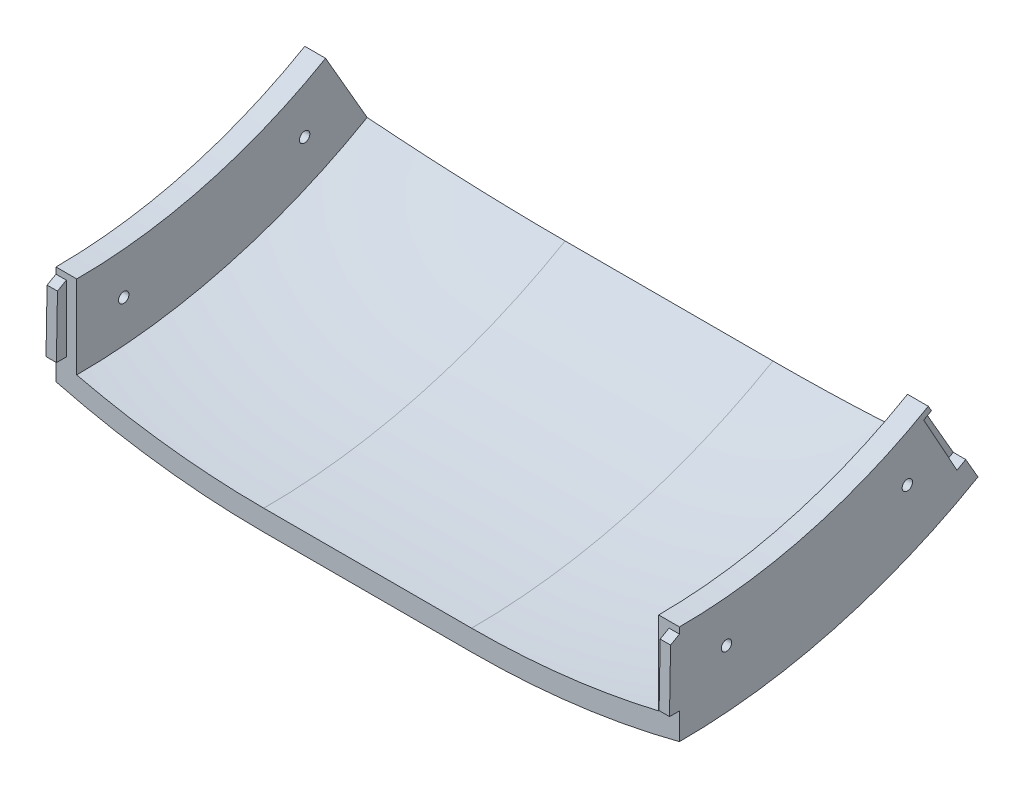
from build123d import *

# Parameters (mm, degrees)
R_VOLUTION3_ANGLE                       = 30
ESQUISSE2_W                             = 5
ESQUISSE2_H                             = 32
R_VOLUTION4_ANGLE                       = 1
ESQUISSE3_W                             = 6
ESQUISSE3_H                             = 33
ENL_VEMENT_DE_MATI_RE_R_VOLUTION1_ANGLE = 1
ENL_V_MAT_EXTRU_1_DEPTH                 = 300
ESQUISSE5_R                             = 2.5
ENL_V_MAT_EXTRU_2_DEPTH                 = 300


with BuildPart() as part:
    # Esquisse1 → Révolution3 (revolve)
    with BuildSketch(Plane.XY):
        with BuildLine():
            Line((-50, -300), (50, -300))
            ThreePointArc((50, -300), (100.401716993, -296.811878507), (150, -287.298334621))
            Line((150, -287.298334621), (150, -239.47331922))
            Line((150, -239.47331922), (140, -239.47331922))
            Line((140, -239.47331922), (140, -279.47331922))
            ThreePointArc((140, -279.47331922), (95.306762763, -287.359390293), (50, -290))
            Line((50, -290), (-50, -290))
            ThreePointArc((-50, -290), (-95.306762763, -287.359390293), (-140, -279.47331922))
            Line((-140, -279.47331922), (-140, -239.47331922))
            Line((-140, -239.47331922), (-150, -239.47331922))
            Line((-150, -239.47331922), (-150, -287.298334621))
            ThreePointArc((-150, -287.298334621), (-100.401716993, -296.811878507), (-50, -300))
        make_face()
    revolve(axis=Axis((0, 0, 0), (1, 0, 0)), revolution_arc=R_VOLUTION3_ANGLE)

    # Esquisse2 → Révolution4 (revolve)
    with BuildSketch(Plane.XY):
        with Locations((-147.5, -258.47331922)):
            Rectangle(ESQUISSE2_W, ESQUISSE2_H)
        with Locations((147.5, -258.47331922)):
            Rectangle(ESQUISSE2_W, ESQUISSE2_H)
    revolve(axis=Axis((-163.497361966, 0, 0), (-1, 0, 0)), revolution_arc=R_VOLUTION4_ANGLE)

    # Esquisse3 → Enlèvement de matière-Révolution1 (revolve, cut)
    with BuildSketch(Plane(origin=(0, 0, 0), x_dir=(1, 0, 0), z_dir=(0, 0.5000000000000011, -0.8660254037844382))):
        with Locations((-147, 258.97331922)):
            Rectangle(ESQUISSE3_W, ESQUISSE3_H)
        with Locations((147, 258.97331922)):
            Rectangle(ESQUISSE3_W, ESQUISSE3_H)
    revolve(axis=Axis((-66.768740816, 0, 0), (-1, 0, 0)), revolution_arc=ENL_VEMENT_DE_MATI_RE_R_VOLUTION1_ANGLE, mode=Mode.SUBTRACT)

    # Esquisse4 → Enlèv. mat.-Extru.1 (cut)
    with BuildSketch(Plane.ZY.offset(150)):
        Polygon((0, -242.47331922), (4.27460179, -244.891772551), (4.231742917, -242.436389359), align=None)
    extrude(amount=-ENL_V_MAT_EXTRU_1_DEPTH, mode=Mode.SUBTRACT)

    # Esquisse5 → Enlèv. mat.-Extru.2 (cut)
    with BuildSketch(Plane.ZY.offset(150)):
        with Locations((-22.614300571, -258.482638314)):
            Circle(ESQUISSE5_R)
        with Locations((-109.656760374, -235.159681502)):
            Circle(ESQUISSE5_R)
    extrude(amount=-ENL_V_MAT_EXTRU_2_DEPTH, mode=Mode.SUBTRACT)


solid = part.part
